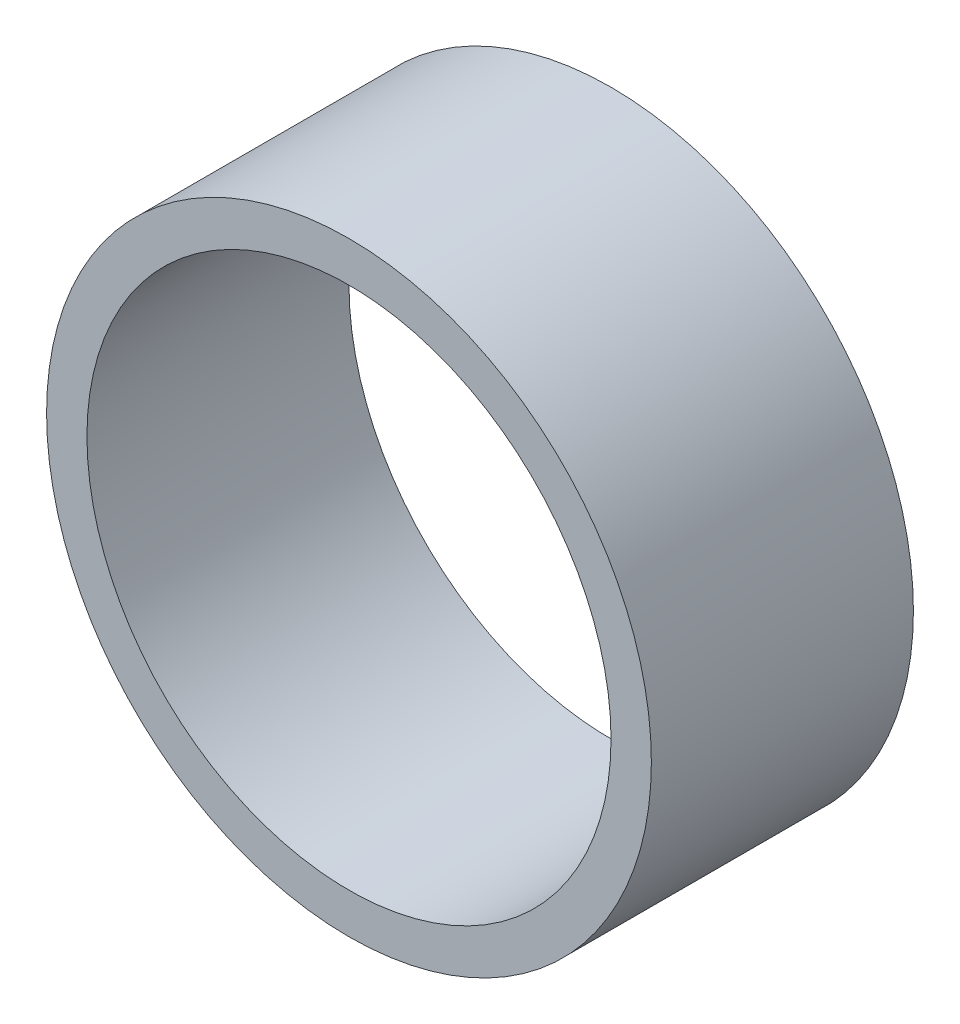
from build123d import *

# Parameters (mm, degrees)
SKETCH1_R           = 11.54
SKETCH1_R_2         = 10
BOSS_EXTRUDE1_DEPTH = 10


with BuildPart() as part:
    # Sketch1 → Boss-Extrude1 (new body)
    with BuildSketch(Plane.XY):
        Circle(SKETCH1_R)
        Circle(SKETCH1_R_2, mode=Mode.SUBTRACT)
    extrude(amount=BOSS_EXTRUDE1_DEPTH)


solid = part.part
